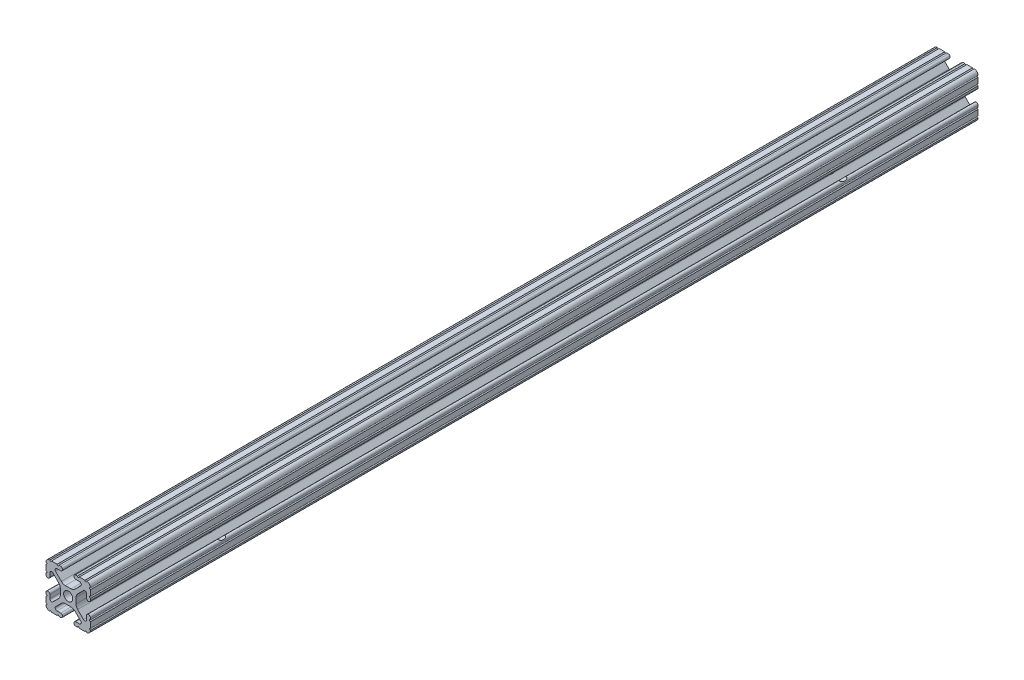
from build123d import *

# Parameters (mm, degrees)
SKETCH1_R                           = 2.6035
MAINEXTRUDE_DEPTH                   = 508
FRAMESUPPORTHOLES_REACH             = 535.702
SKETCH3_R                           = 3.81
FRAMESUPPORTHOLES_DIRECTION_2_REACH = 535.702
SKETCH4_R                           = 10.31875
COUNTERBORE_DEPTH                   = 2.2098


with BuildPart() as part:
    # Sketch1 → MainExtrude (new body)
    with BuildSketch(Plane(origin=(0, 0, -25.4), x_dir=(-1, 0, 0), z_dir=(0, 0, -1))):
        with BuildLine():
            Line((12.7, -9.5504), (12.7, -6.3330836))
            ThreePointArc((12.7, -6.3330836), (12.192, -5.8250836), (12.7, -5.3170836))
            Line((12.7, -5.3170836), (12.7, -4.3434))
            ThreePointArc((12.7, -4.3434), (11.5951, -3.2385), (10.4902, -4.3434))
            Line((10.4902, -4.3434), (10.4902, -6.474794456))
            ThreePointArc((10.4902, -6.474794456), (9.863006367, -7.413456061), (8.75577951, -7.193214945))
            Line((8.75577951, -7.193214945), (5.42573597, -3.863171405))
            ThreePointArc((5.42573597, -3.863171405), (4.737482484, -2.833127272), (4.4958, -1.618107374))
            Line((4.4958, -1.618107374), (4.4958, 1.618107374))
            ThreePointArc((4.4958, 1.618107374), (4.737482484, 2.833127272), (5.42573597, 3.863171405))
            Line((5.42573597, 3.863171405), (8.75577951, 7.193214945))
            ThreePointArc((8.75577951, 7.193214945), (9.863006367, 7.413456061), (10.4902, 6.474794456))
            Line((10.4902, 6.474794456), (10.4902, 4.343399971))
            ThreePointArc((10.4902, 4.343399971), (11.5951, 3.238499971), (12.7, 4.343399971))
            Line((12.7, 4.343399971), (12.7, 5.3170836))
            ThreePointArc((12.7, 5.3170836), (12.192, 5.8250836), (12.7, 6.3330836))
            Line((12.7, 6.3330836), (12.7, 9.5504))
            ThreePointArc((12.7, 9.5504), (12.192000006, 10.058323491), (12.699846982, 10.566399977))
            ThreePointArc((12.699846982, 10.566399977), (12.082522516, 12.082522516), (10.566399977, 12.699846982))
            ThreePointArc((10.566399977, 12.699846982), (10.058323491, 12.192000006), (9.5504, 12.7))
            Line((9.5504, 12.7), (6.3330836, 12.7))
            ThreePointArc((6.3330836, 12.7), (5.8250836, 12.192), (5.3170836, 12.7))
            Line((5.3170836, 12.7), (4.3434, 12.7))
            ThreePointArc((4.3434, 12.7), (3.2385, 11.5951), (4.3434, 10.4902))
            Line((4.3434, 10.4902), (6.474794456, 10.4902))
            ThreePointArc((6.474794456, 10.4902), (7.413456061, 9.863006367), (7.193214945, 8.75577951))
            Line((7.193214945, 8.75577951), (3.863171405, 5.42573597))
            ThreePointArc((3.863171405, 5.42573597), (2.833127272, 4.737482484), (1.618107374, 4.4958))
            Line((1.618107374, 4.4958), (-1.618107374, 4.4958))
            ThreePointArc((-1.618107374, 4.4958), (-2.833127272, 4.737482484), (-3.863171405, 5.42573597))
            Line((-3.863171405, 5.42573597), (-7.193214945, 8.75577951))
            ThreePointArc((-7.193214945, 8.75577951), (-7.413456061, 9.863006367), (-6.474794456, 10.4902))
            Line((-6.474794456, 10.4902), (-4.343399971, 10.4902))
            ThreePointArc((-4.343399971, 10.4902), (-3.238499971, 11.5951), (-4.343399971, 12.7))
            Line((-4.343399971, 12.7), (-5.3170836, 12.7))
            ThreePointArc((-5.3170836, 12.7), (-5.8250836, 12.192), (-6.3330836, 12.7))
            Line((-6.3330836, 12.7), (-9.5504, 12.7))
            ThreePointArc((-9.5504, 12.7), (-10.058323491, 12.192000006), (-10.566399977, 12.699846982))
            ThreePointArc((-10.566399977, 12.699846982), (-12.082522516, 12.082522516), (-12.699846982, 10.566399977))
            ThreePointArc((-12.699846982, 10.566399977), (-12.192000006, 10.058323491), (-12.7, 9.5504))
            Line((-12.7, 9.5504), (-12.7, 6.3330836))
            ThreePointArc((-12.7, 6.3330836), (-12.192, 5.8250836), (-12.7, 5.3170836))
            Line((-12.7, 5.3170836), (-12.7, 4.3434))
            ThreePointArc((-12.7, 4.3434), (-11.5951, 3.2385), (-10.4902, 4.3434))
            Line((-10.4902, 4.3434), (-10.4902, 6.474794456))
            ThreePointArc((-10.4902, 6.474794456), (-9.863006367, 7.413456061), (-8.75577951, 7.193214945))
            Line((-8.75577951, 7.193214945), (-5.42573597, 3.863171405))
            ThreePointArc((-5.42573597, 3.863171405), (-4.737482484, 2.833127272), (-4.4958, 1.618107374))
            Line((-4.4958, 1.618107374), (-4.4958, -1.618107374))
            ThreePointArc((-4.4958, -1.618107374), (-4.737482484, -2.833127272), (-5.42573597, -3.863171405))
            Line((-5.42573597, -3.863171405), (-8.75577951, -7.193214945))
            ThreePointArc((-8.75577951, -7.193214945), (-9.863006367, -7.413456061), (-10.4902, -6.474794456))
            Line((-10.4902, -6.474794456), (-10.4902, -4.343399971))
            ThreePointArc((-10.4902, -4.343399971), (-11.5951, -3.238499971), (-12.7, -4.343399971))
            Line((-12.7, -4.343399971), (-12.7, -5.3170836))
            ThreePointArc((-12.7, -5.3170836), (-12.192, -5.8250836), (-12.7, -6.3330836))
            Line((-12.7, -6.3330836), (-12.7, -9.5504))
            ThreePointArc((-12.7, -9.5504), (-12.192000006, -10.058323491), (-12.699846982, -10.566399977))
            ThreePointArc((-12.699846982, -10.566399977), (-12.082522516, -12.082522516), (-10.566399977, -12.699846982))
            ThreePointArc((-10.566399977, -12.699846982), (-10.058323491, -12.192000006), (-9.5504, -12.7))
            Line((-9.5504, -12.7), (-6.3330836, -12.7))
            ThreePointArc((-6.3330836, -12.7), (-5.8250836, -12.192), (-5.3170836, -12.7))
            Line((-5.3170836, -12.7), (-4.3434, -12.7))
            ThreePointArc((-4.3434, -12.7), (-3.2385, -11.5951), (-4.3434, -10.4902))
            Line((-4.3434, -10.4902), (-6.474794456, -10.4902))
            ThreePointArc((-6.474794456, -10.4902), (-7.413456061, -9.863006367), (-7.193214945, -8.75577951))
            Line((-7.193214945, -8.75577951), (-3.863171405, -5.42573597))
            ThreePointArc((-3.863171405, -5.42573597), (-2.833127272, -4.737482484), (-1.618107374, -4.4958))
            Line((-1.618107374, -4.4958), (1.618107374, -4.4958))
            ThreePointArc((1.618107374, -4.4958), (2.833127272, -4.737482484), (3.863171405, -5.42573597))
            Line((3.863171405, -5.42573597), (7.193214945, -8.75577951))
            ThreePointArc((7.193214945, -8.75577951), (7.413456061, -9.863006367), (6.474794456, -10.4902))
            Line((6.474794456, -10.4902), (4.343399971, -10.4902))
            ThreePointArc((4.343399971, -10.4902), (3.238499971, -11.5951), (4.343399971, -12.7))
            Line((4.343399971, -12.7), (5.3170836, -12.7))
            ThreePointArc((5.3170836, -12.7), (5.8250836, -12.192), (6.3330836, -12.7))
            Line((6.3330836, -12.7), (9.5504, -12.7))
            ThreePointArc((9.5504, -12.7), (10.058323491, -12.192000006), (10.566399977, -12.699846982))
            ThreePointArc((10.566399977, -12.699846982), (12.082522516, -12.082522516), (12.699846982, -10.566399977))
            ThreePointArc((12.699846982, -10.566399977), (12.192000006, -10.058323491), (12.7, -9.5504))
        make_face()
        with Locations(Location((0, 0, 0), (0, 0, 180))):
            Circle(SKETCH1_R, mode=Mode.SUBTRACT)
    extrude(amount=MAINEXTRUDE_DEPTH)

    # FrameSupportHoles: up to this face of the body (flat: up to its plane)
    framesupportholes_end = Plane(part.part.faces().sort_by_distance((-12.7, 7.9417418, -279.4))[0])
    # Sketch3 → FrameSupportHoles (cut, up to the picked face)
    with BuildSketch(Plane(origin=(0, 0, 0), x_dir=(0, 0, -1), z_dir=(1, 0, 0)), mode=Mode.PRIVATE) as framesupportholes_sk1:
        with Locations(Location((101.6, 0, 0), (0, 0, 334.868317911))):
            Circle(SKETCH3_R)
    framesupportholes_tool1 = split(extrude(framesupportholes_sk1.sketch, amount=-FRAMESUPPORTHOLES_REACH, mode=Mode.PRIVATE), bisect_by=framesupportholes_end, keep=Keep.BOTH, mode=Mode.PRIVATE)
    # Sketch3 → FrameSupportHoles (cut, up to the picked face)
    with BuildSketch(Plane(origin=(0, 0, 0), x_dir=(0, 0, -1), z_dir=(1, 0, 0)), mode=Mode.PRIVATE) as framesupportholes_sk2:
        with Locations(Location((457.2, 0, 0), (0, 0, 334.868317911))):
            Circle(SKETCH3_R)
    framesupportholes_tool2 = split(extrude(framesupportholes_sk2.sketch, amount=-FRAMESUPPORTHOLES_REACH, mode=Mode.PRIVATE), bisect_by=framesupportholes_end, keep=Keep.BOTH, mode=Mode.PRIVATE)
    add(framesupportholes_tool1.solids().sort_by(Axis((0, 0, -101.6), (-1, 0, 0)))[0], mode=Mode.SUBTRACT)
    add(framesupportholes_tool2.solids().sort_by(Axis((0, 0, -457.2), (-1, 0, 0)))[0], mode=Mode.SUBTRACT)

    # FrameSupportHoles direction 2: up to this face of the body (flat: up to its plane)
    framesupportholes_direction_2_end = Plane(part.part.faces().sort_by_distance((12.7, 7.9417418, -279.4))[0])
    # Sketch3 → FrameSupportHoles direction 2 (cut, up to the picked face)
    with BuildSketch(Plane(origin=(0, 0, 0), x_dir=(0, 0, -1), z_dir=(1, 0, 0)), mode=Mode.PRIVATE) as framesupportholes_direction_2_sk1:
        with Locations(Location((101.6, 0, 0), (0, 0, 334.868317911))):
            Circle(SKETCH3_R)
    framesupportholes_direction_2_tool1 = split(extrude(framesupportholes_direction_2_sk1.sketch, amount=FRAMESUPPORTHOLES_DIRECTION_2_REACH, mode=Mode.PRIVATE), bisect_by=framesupportholes_direction_2_end, keep=Keep.BOTH, mode=Mode.PRIVATE)
    # Sketch3 → FrameSupportHoles direction 2 (cut, up to the picked face)
    with BuildSketch(Plane(origin=(0, 0, 0), x_dir=(0, 0, -1), z_dir=(1, 0, 0)), mode=Mode.PRIVATE) as framesupportholes_direction_2_sk2:
        with Locations(Location((457.2, 0, 0), (0, 0, 334.868317911))):
            Circle(SKETCH3_R)
    framesupportholes_direction_2_tool2 = split(extrude(framesupportholes_direction_2_sk2.sketch, amount=FRAMESUPPORTHOLES_DIRECTION_2_REACH, mode=Mode.PRIVATE), bisect_by=framesupportholes_direction_2_end, keep=Keep.BOTH, mode=Mode.PRIVATE)
    add(framesupportholes_direction_2_tool1.solids().sort_by(Axis((0, 0, -101.6), (1, 0, 0)))[0], mode=Mode.SUBTRACT)
    add(framesupportholes_direction_2_tool2.solids().sort_by(Axis((0, 0, -457.2), (1, 0, 0)))[0], mode=Mode.SUBTRACT)

    # Sketch4 → CounterBore (cut)
    with BuildSketch(Plane.ZY.offset(12.7)):
        with Locations((-101.6, 0)):
            Circle(SKETCH4_R)
    extrude(amount=-COUNTERBORE_DEPTH, mode=Mode.SUBTRACT)


solid = part.part
